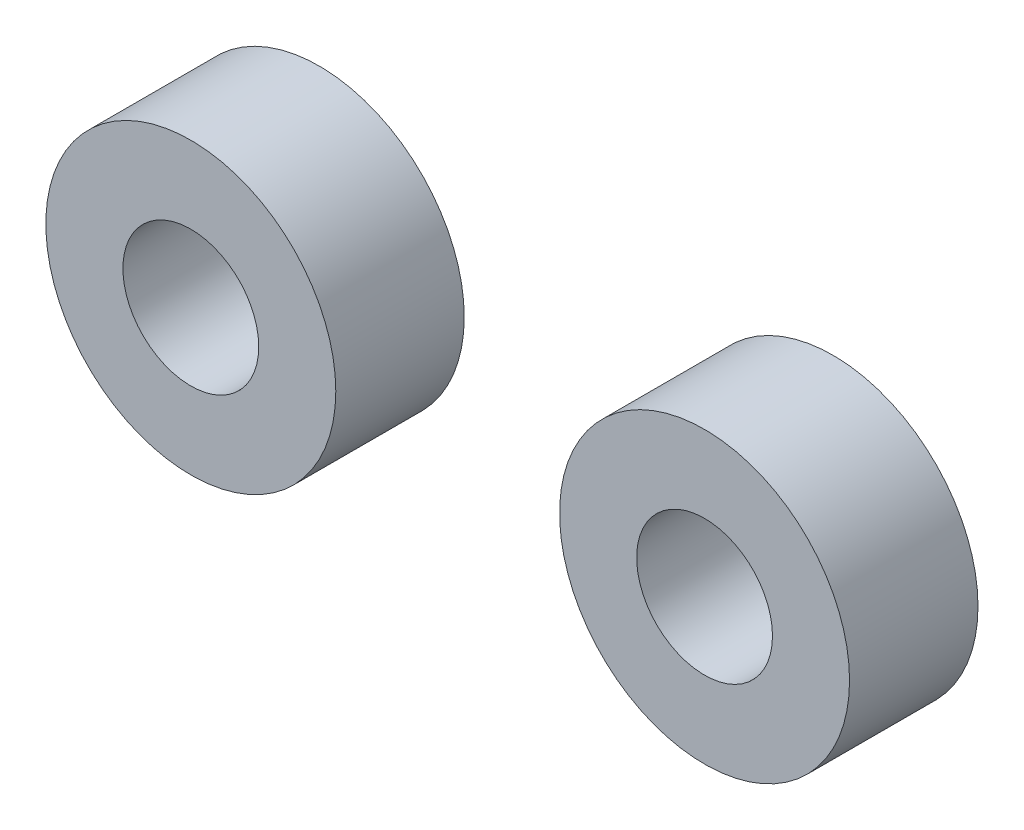
from build123d import *

# Parameters (mm, degrees)
SKETCH_1_R        = 5.643613852
SKETCH_1_R_2      = 2.643613852
EXTRUDE_1_DEPTH   = 5
EXTRUDE_1_2_DEPTH = 5
SKETCH_1_2_R      = 5.643613852
SKETCH_1_2_R_2    = 2.643613852
EXTRUDE_2_DEPTH   = 5


with BuildPart() as part:
    # 草图1 → 凸台-拉伸1 (new body)
    with BuildSketch(Plane.XY):
        with Locations((-49.959466428, 14.391315389)):
            Circle(SKETCH_1_R)
        with Locations((-49.959466428, 14.391315389)):
            Circle(SKETCH_1_R_2, mode=Mode.SUBTRACT)
    extrude(amount=EXTRUDE_1_DEPTH)



with BuildPart() as body_2:
    # 草图1 → Extrude 1 2 (new body)
    with BuildSketch(Plane.XY):
        with Locations((-29.961022302, 14.640779915)):
            Circle(SKETCH_1_R)
        with Locations((-29.961022302, 14.640779915)):
            Circle(SKETCH_1_R_2, mode=Mode.SUBTRACT)
    extrude(amount=EXTRUDE_1_2_DEPTH)


with BuildPart() as part_1:
    add(part.part)

    add(body_2.part)  # 凸台-拉伸2 merges body 2
    # 草图1<2> → 凸台-拉伸2 (add)
    # profile 1 of 2: a face of its own
    with BuildSketch(Plane.XY):
        with Locations((-49.959466428, 14.391315389)):
            Circle(SKETCH_1_2_R)
        with Locations((-49.959466428, 14.391315389)):
            Circle(SKETCH_1_2_R_2, mode=Mode.SUBTRACT)
    # profile 2 of 2: a face of its own
    with BuildSketch(Plane.XY):
        with Locations((-29.961022302, 14.640779915)):
            Circle(SKETCH_1_2_R)
        with Locations((-29.961022302, 14.640779915)):
            Circle(SKETCH_1_2_R_2, mode=Mode.SUBTRACT)
    extrude(amount=EXTRUDE_2_DEPTH)


solid = part_1.part
